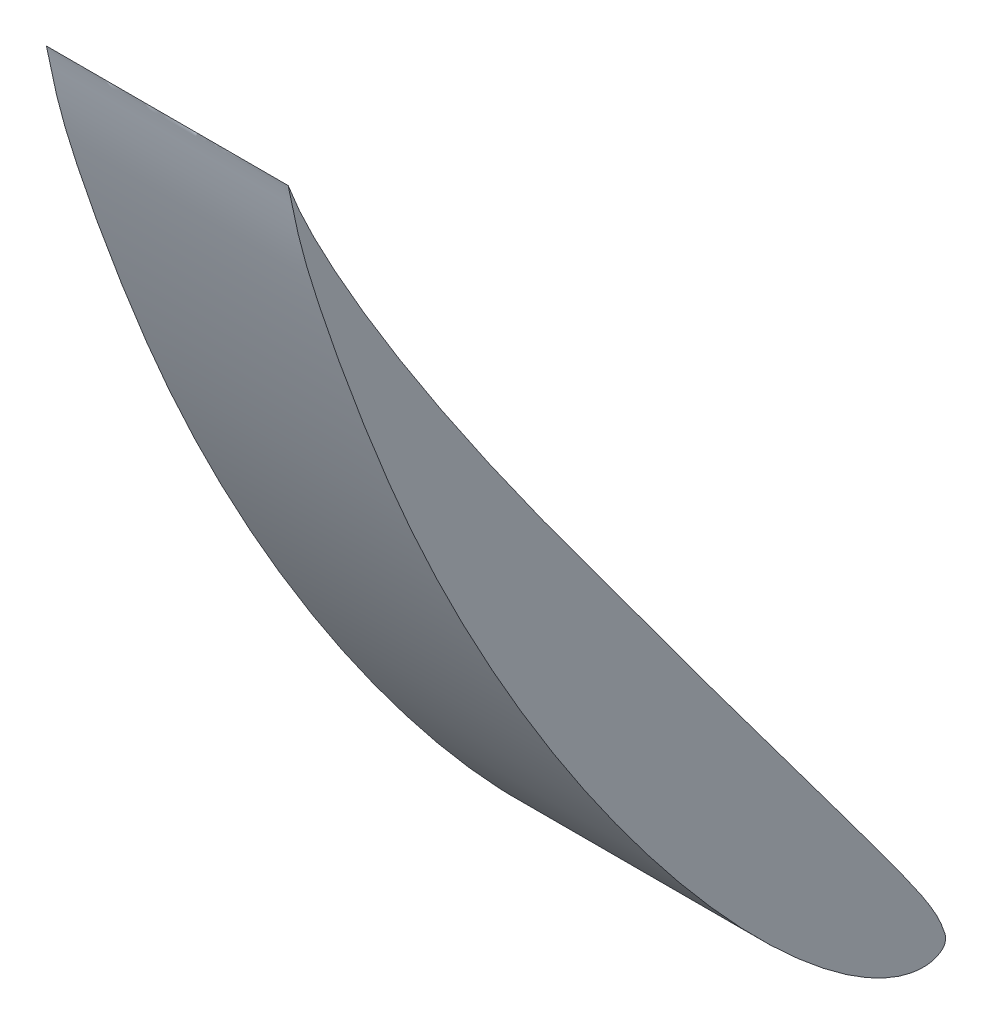
from build123d import *

# Parameters (mm, degrees)
BOSS_EXTRUDE1_DEPTH = 10


with BuildPart() as part:
    # Sketch2 → Boss-Extrude1 (new body)
    with BuildSketch(Plane(origin=(20, 0, 0), x_dir=(0, 0, -1), z_dir=(1, 0, 0))):
        with BuildLine():
            add(Edge.make_bspline(
                [(-15.918165439, 28.663935106), (-15.919690371, 28.663242515), (-15.864962971, 28.466849711), (-15.830269178, 28.266464495), (-15.733815829, 27.804971407), (-15.626094278, 27.257027762), (-15.472940643, 26.569129373), (-15.267644604, 25.777392485), (-15.00188315, 24.875345717), (-14.683976651, 23.866552865), (-14.316633682, 22.756215007), (-13.90133928, 21.554547144), (-13.440642244, 20.271405392), (-12.936120714, 18.917744291), (-12.389862085, 17.504886328), (-11.8025913, 16.045367505), (-11.174838928, 14.550236119), (-10.498906318, 13.031490873), (-9.776987343, 11.49630726), (-9.013056562, 9.950710644), (-8.206219111, 8.404171529), (-7.363034347, 6.862491014), (-6.485671524, 5.334081965), (-5.577467126, 3.827796107), (-4.645804244, 2.349387002), (-3.692441051, 0.908059236), (-2.723689974, -0.489610544), (-1.745437213, -1.83716908), (-0.762712417, -3.12729875), (0.217852134, -4.354234892), (1.191019431, -5.511490314), (2.151019886, -6.593078251), (3.091104042, -7.594761745), (4.006768676, -8.510910372), (4.891740739, -9.337842434), (5.740306688, -10.072540004), (6.547849373, -10.711010172), (7.30754839, -11.253619269), (8.017856844, -11.696095734), (8.674328473, -12.037223258), (9.269904062, -12.28581002), (9.806168465, -12.434898961), (10.272978612, -12.493492255), (10.672559965, -12.471164967), (10.981540109, -12.354405011), (11.230320633, -12.187405885), (11.308262504, -11.878363666), (11.186976825, -11.518520557), (11.000019035, -11.052297335), (10.678753277, -10.480205059), (10.244576493, -9.801184814), (9.697277904, -9.009418739), (9.045833149, -8.104909388), (8.299325793, -7.089885957), (7.466706768, -5.96989458), (6.555695471, -4.752207161), (5.575898207, -3.443739361), (4.535568643, -2.053487814), (3.444354063, -0.590271118), (2.310820889, 0.935495091), (1.144122029, 2.513068587), (-0.047255707, 4.131290768), (-1.25784158, 5.77790028), (-2.484580344, 7.441767515), (-3.718826266, 9.117877343), (-4.95078485, 10.8002043), (-6.162381126, 12.483406068), (-7.338779064, 14.155406562), (-8.471259464, 15.799677826), (-9.549250027, 17.40282735), (-10.563360007, 18.951674857), (-11.504946729, 20.43272445), (-12.366112288, 21.832402135), (-13.140392105, 23.13711547), (-13.821975198, 24.333038353), (-14.407443681, 25.40835855), (-14.892993916, 26.345761135), (-15.280376655, 27.145599787), (-15.557606675, 27.759138429), (-15.75939467, 28.261333292), (-15.846578786, 28.46327486), (-15.916625315, 28.664634596), (-15.918165439, 28.663935106)],
                knots=[0, 0, 0, 0, 0.000978925, 0.003785915, 0.008178786, 0.013939636, 0.020914584, 0.029056598, 0.038413559, 0.048973972, 0.060645419, 0.073333851, 0.086939075, 0.101355023, 0.116470865, 0.132170767, 0.148332165, 0.164889948, 0.181806831, 0.198986829, 0.216369093, 0.233891214, 0.251455205, 0.268989944, 0.286410199, 0.30363306, 0.320588513, 0.33718727, 0.353353473, 0.369012335, 0.384083455, 0.398499749, 0.412191497, 0.425098469, 0.437171363, 0.448351495, 0.458605679, 0.467900991, 0.476215593, 0.483572991, 0.489970137, 0.495456444, 0.500131703, 0.503991848, 0.507230008, 0.509986767, 0.512500662, 0.516073685, 0.521095012, 0.527571392, 0.53558732, 0.545177111, 0.556301643, 0.568874715, 0.582800206, 0.597975202, 0.614286016, 0.631612678, 0.649825892, 0.668791608, 0.688371086, 0.708416853, 0.728796853, 0.749399049, 0.770145767, 0.790953093, 0.811664203, 0.832074041, 0.851999344, 0.871281672, 0.889760566, 0.907279934, 0.923686414, 0.93883251, 0.952579327, 0.964796492, 0.975364982, 0.984179192, 0.991107071, 0.996049394, 0.999011322, 1, 1, 1, 1], degree=3))
        make_face()
    extrude(amount=BOSS_EXTRUDE1_DEPTH)


solid = part.part
